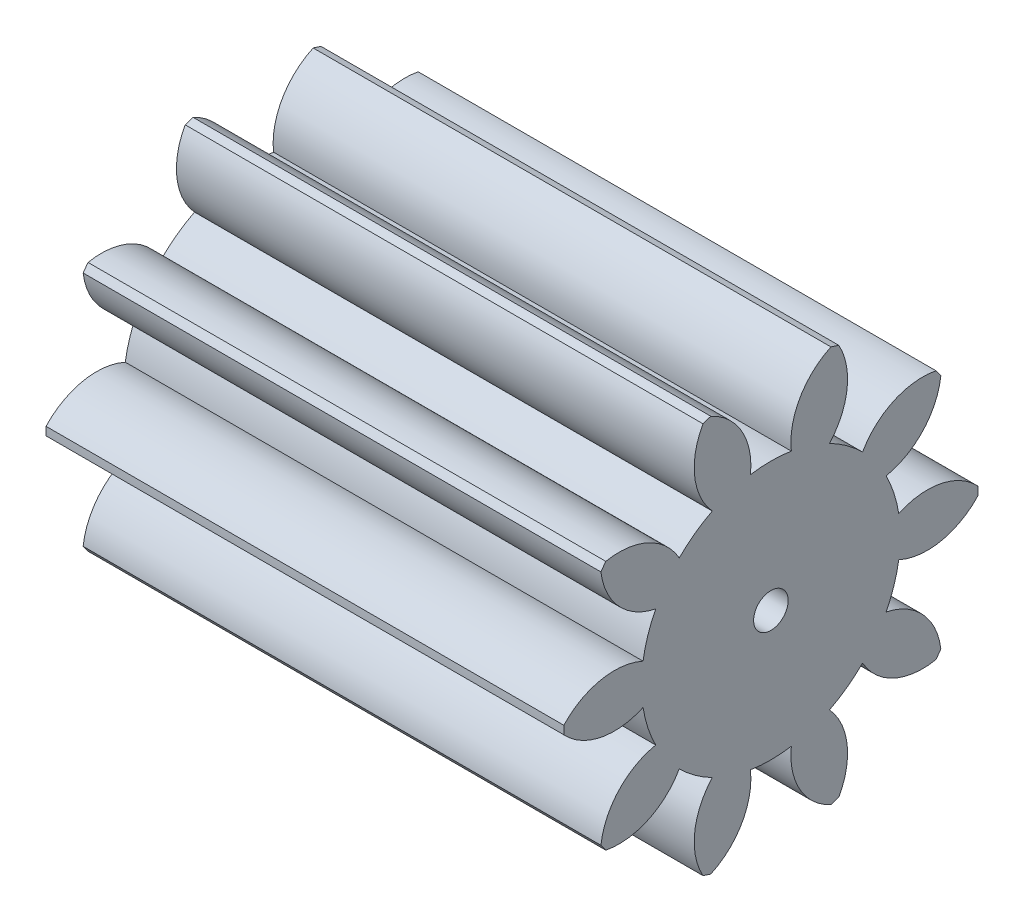
from build123d import *

# Parameters (mm, degrees)
BASPROSKE_W     = 12
BASPROSKE_H     = 4.8
TOOTHCUT_DEPTH  = 14.786950352
TEETHCUTS_COUNT = 10
TEETHCUTS_ANGLE = 324
BORSKE_R        = 0.4
BORE_DEPTH      = 50.0000508


with BuildPart() as part:
    # BasProSke → Base-Revolve (revolve)
    with BuildSketch(Plane(origin=(0, 0, 0), x_dir=(1, 0, 0), z_dir=(0, 1, 0)), mode=Mode.PRIVATE) as base_revolve_sk:
        with Locations((6, 2.4)):
            Rectangle(BASPROSKE_W, BASPROSKE_H)
    revolve(base_revolve_sk.sketch.rotate(Axis((-10, 0, 0), (1, 0, 0)), 180), axis=Axis((-10, 0, 0), (1, 0, 0)))

    # TooCutSke → ToothCut (cut, through all)
    with BuildSketch(Plane(origin=(0, 0, 0), x_dir=(0, 0, -1), z_dir=(1, 0, 0))):
        with BuildLine():
            ThreePointArc((0.473726058, 2.961348446), (0, 2.999), (-0.473726058, 2.961348446))
            ThreePointArc((-0.473726058, 2.961348446), (-0.678470427, 3.942691912), (-1.42693485, 4.6095924))
            ThreePointArc((-1.42693485, 4.6095924), (0, 4.8254), (1.42693485, 4.6095924))
            ThreePointArc((1.42693485, 4.6095924), (0.678470427, 3.942691912), (0.473726058, 2.961348446))
        make_face()
    toothcut = extrude(amount=TOOTHCUT_DEPTH, mode=Mode.SUBTRACT)

    # TeethCuts: ToothCut ×10 about axis
    teethcuts_axis = Axis((-10, 0, 0), (1, 0, 0))
    for i in range(1, TEETHCUTS_COUNT):
        add(toothcut.rotate(teethcuts_axis, i * TEETHCUTS_ANGLE / (TEETHCUTS_COUNT - 1)), mode=Mode.SUBTRACT)

    # BorSke → Bore (cut, symmetric)
    with BuildSketch(Plane(origin=(0, 0, 0), x_dir=(0, 0, -1), z_dir=(1, 0, 0))):
        with Locations(Location((0, 0, 0), (0, 0, 180))):
            Circle(BORSKE_R)
    extrude(amount=BORE_DEPTH, both=True, mode=Mode.SUBTRACT)


solid = part.part
